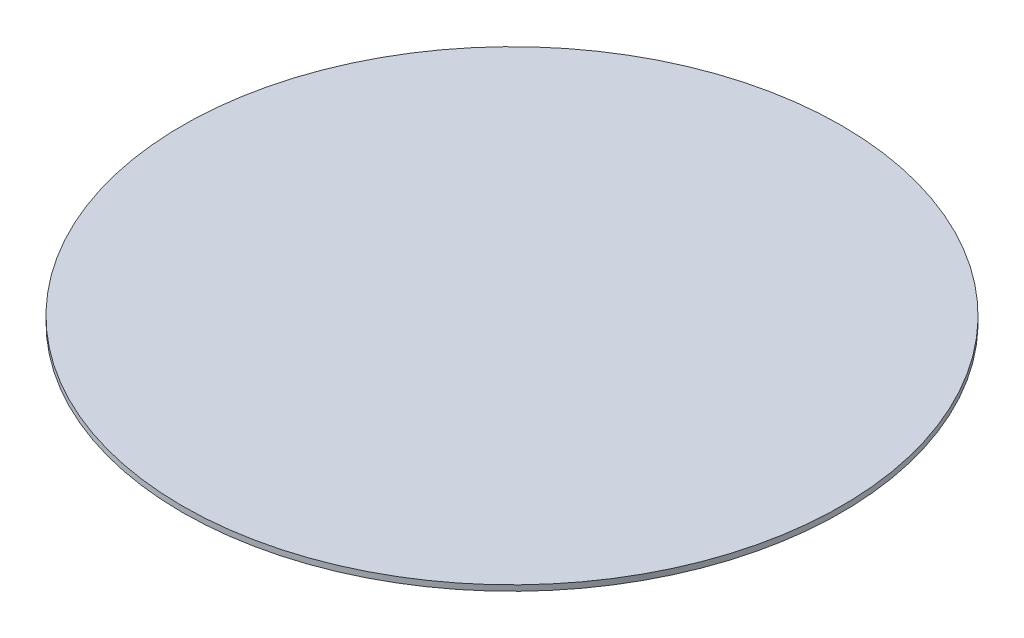
from build123d import *

# Parameters (mm, degrees)
SKETCH1_R           = 161.5
BOSS_EXTRUDE1_DEPTH = 2.75


with BuildPart() as part:
    # Sketch1 → Boss-Extrude1 (new body)
    with BuildSketch(Plane(origin=(0, 0, 0), x_dir=(1, 0, 0), z_dir=(0, 1, 0))):
        with Locations(Location((0, 0, 0), (0, 0, 270))):
            Circle(SKETCH1_R)
    extrude(amount=BOSS_EXTRUDE1_DEPTH)


solid = part.part
